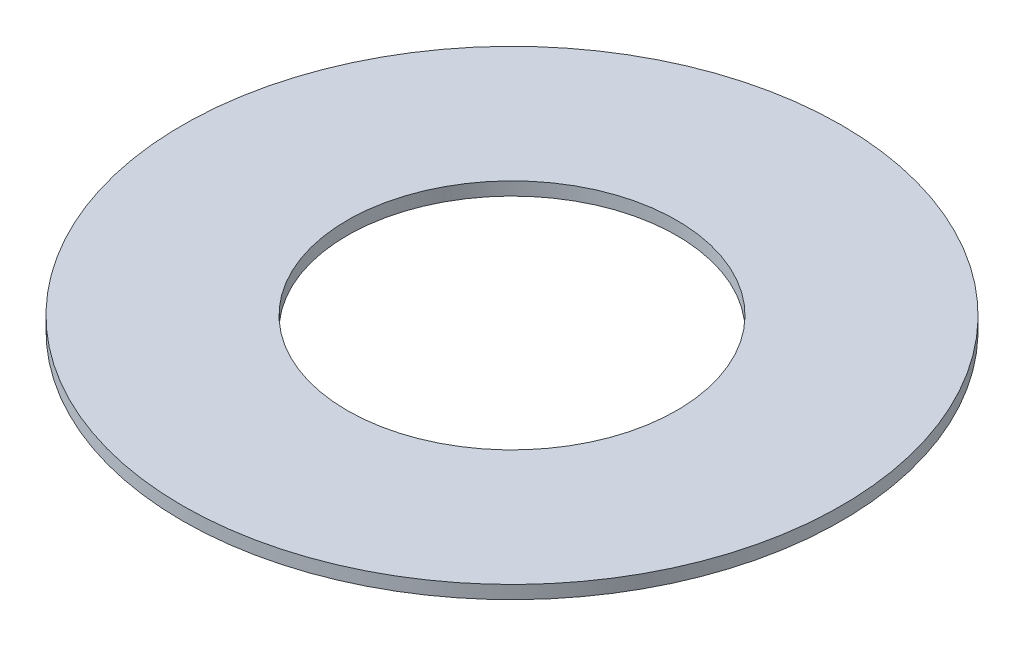
from build123d import *

# Parameters (mm, degrees)
SKETCH1_R           = 5
BOSS_EXTRUDE1_DEPTH = 0.2
SKETCH5_R           = 2.5
CUT_EXTRUDE1_DEPTH  = 8.073895674


with BuildPart() as part:
    # Sketch1 → Boss-Extrude1 (new body)
    with BuildSketch(Plane(origin=(0, 0, 0), x_dir=(1, 0, 0), z_dir=(0, 1, 0))):
        with Locations(Location((0, 0, 0), (0, 0, 270))):
            Circle(SKETCH1_R)
    extrude(amount=BOSS_EXTRUDE1_DEPTH)

    # Sketch5 → Cut-Extrude1 (cut, through all)
    with BuildSketch(Plane(origin=(0, 0.2, 0), x_dir=(-1, 0, 0), z_dir=(0, 1, 0))):
        with Locations(Location((0, 0, 0), (0, 0, 90))):
            Circle(SKETCH5_R)
    extrude(amount=-CUT_EXTRUDE1_DEPTH, mode=Mode.SUBTRACT)


solid = part.part
